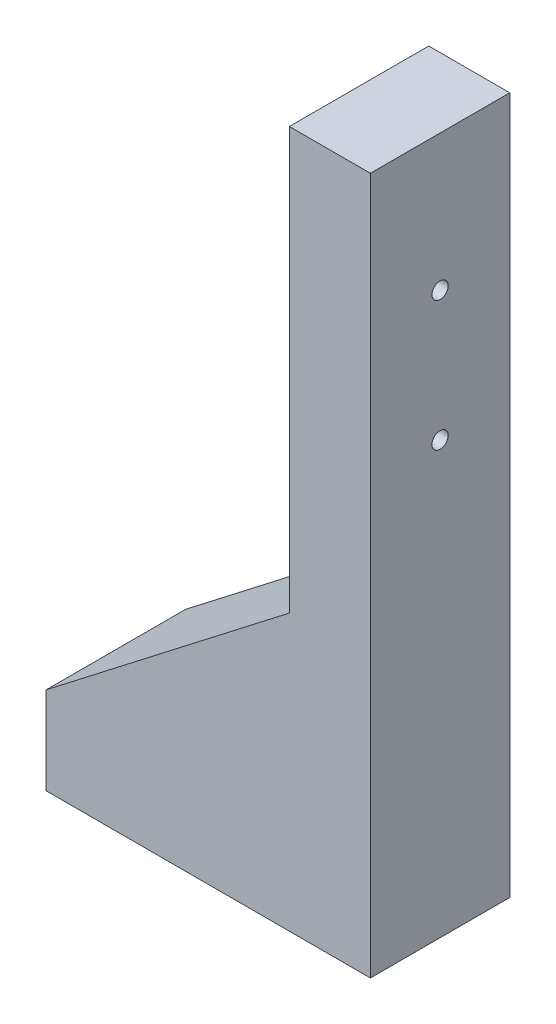
from build123d import *

# Parameters (mm, degrees)
BOSS_EXTRUDE1_DEPTH = 43
SKETCH2_R           = 2.5
CUT_EXTRUDE1_DEPTH  = 25


with BuildPart() as part:
    # Sketch1 → Boss-Extrude1 (new body)
    with BuildSketch(Plane.XY):
        Polygon((0, 0), (0, 130), (25, 130), (25, -85), (-75, -85), (-75, -58), align=None)
    extrude(amount=BOSS_EXTRUDE1_DEPTH)

    # Sketch2 → Cut-Extrude1 (cut)
    with BuildSketch(Plane.ZY):
        with Locations((21.5, 88)):
            Circle(SKETCH2_R)
        with Locations((21.5, 48)):
            Circle(SKETCH2_R)
    extrude(amount=-CUT_EXTRUDE1_DEPTH, mode=Mode.SUBTRACT)


solid = part.part
